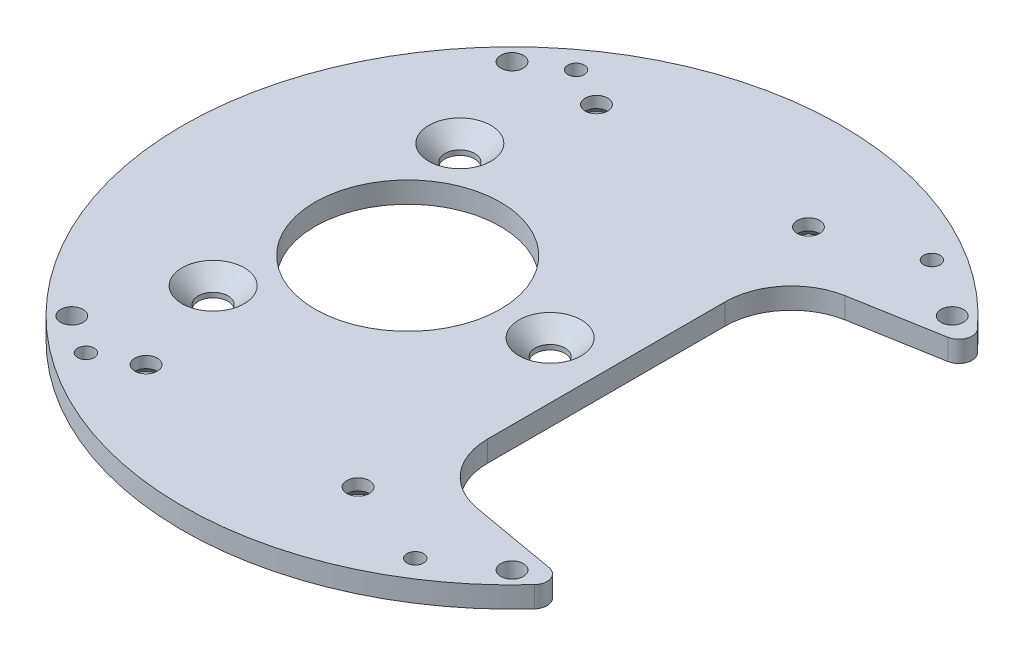
from build123d import *

# Parameters (mm, degrees)
SKETCH1_R                                       = 49.75
BOSS_EXTRUDE1_DEPTH                             = 3.175
CUT_EXTRUDE1_DEPTH                              = 71.428727271
SKETCH3_R                                       = 14
CUT_EXTRUDE2_DEPTH                              = 71.428727271
CIRPATTERN1_COUNT                               = 3
F_3_4_3_4_DIAMETER_HOLE1_D                      = 3.4
CIRPATTERN2_COUNT                               = 4
CSK_FOR_M3_FLAT_HEAD_MACHINE_SCREW2_D           = 3.4
CSK_FOR_M3_FLAT_HEAD_MACHINE_SCREW2_CSINK_D     = 6.3
CSK_FOR_M3_FLAT_HEAD_MACHINE_SCREW2_CSINK_ANGLE = 90
FILLET1_R                                       = 2
FILLET2_R                                       = 10
M3X0_5_TAPPED_HOLE1_D                           = 2.5


with BuildPart() as part:
    # Sketch1 → Boss-Extrude1 (new body)
    with BuildSketch(Plane(origin=(0, 0, 0), x_dir=(1, 0, 0), z_dir=(0, 1, 0))):
        Circle(SKETCH1_R)
    extrude(amount=BOSS_EXTRUDE1_DEPTH)

    # Sketch2 → Cut-Extrude1 (cut, through all)
    with BuildSketch(Plane(origin=(0, 3.175, 0), x_dir=(1, 0, 0), z_dir=(0, 1, 0))):
        with BuildLine():
            Line((33.834716203, 29.780120501), (14.25, 26.326806625))
            Line((14.25, 26.326806625), (14.25, -26.326806625))
            Line((14.25, -26.326806625), (39.136360913, -30.714943505))
            ThreePointArc((39.136360913, -30.714943505), (47.021784608, -16.248516003), (49.75, 0))
            ThreePointArc((49.75, 0), (47.021784608, 16.248516003), (39.136360913, 30.714943505))
            Line((39.136360913, 30.714943505), (33.834716203, 29.780120501))
        make_face()
    extrude(amount=-CUT_EXTRUDE1_DEPTH, mode=Mode.SUBTRACT)

    # Sketch3 → Cut-Extrude2 (cut, through all)
    with BuildSketch(Plane(origin=(0, 3.175, 0), x_dir=(1, 0, 0), z_dir=(0, 1, 0))):
        with Locations((-15.75, 0)):
            Circle(SKETCH3_R)
    extrude(amount=-CUT_EXTRUDE2_DEPTH, mode=Mode.SUBTRACT)

    # Sketch6 → CSK for M4 Flat Head Machine Screw1 (revolve, cut)
    with BuildSketch(Plane(origin=(5.75, 3.175, 0), x_dir=(0, 0, 1), z_dir=(1, 0, 0))):
        Polygon((0, 0), (0, 3.175), (2.25, 3.175), (2.25, 2.45), (4.7, 0), align=None)
    csk_for_m4_flat_head_machine_screw1 = revolve(axis=Axis((5.75, 9.525, 0), (0, -1, 0)), mode=Mode.SUBTRACT)

    # CirPattern1: CSK for M4 Flat Head Machine Screw1 ×3 about axis
    cirpattern1_axis = Axis((-15.75, 3.175, 0), (0, 1, 0))
    for i in range(1, CIRPATTERN1_COUNT):
        add(csk_for_m4_flat_head_machine_screw1.rotate(cirpattern1_axis, i * 360 / CIRPATTERN1_COUNT), mode=Mode.SUBTRACT)

    # Ø3.4 (3.4) Diameter Hole1 (through all)
    with Locations(Plane(origin=(0, 0, 0), x_dir=(-1, 0, 0), z_dir=(0, -1, 0))):
        with Locations((-33.226947648, 33.226947648)):
            f_3_4_3_4_diameter_hole1 = Hole(F_3_4_3_4_DIAMETER_HOLE1_D / 2)

    # CirPattern2: Ø3.4 (3.4) Diameter Hole1 ×4 about axis
    cirpattern2_axis = Axis((0, 3.175, 0), (0, -1, 0))
    for i in range(1, CIRPATTERN2_COUNT):
        add(f_3_4_3_4_diameter_hole1.rotate(cirpattern2_axis, i * 360 / CIRPATTERN2_COUNT), mode=Mode.SUBTRACT)

    # CSK for M3 Flat Head Machine Screw2 (through all)
    with Locations(Plane(origin=(0, 0, 0), x_dir=(-1, 0, 0), z_dir=(0, -1, 0))):
        with Locations((21.25, -34), (-10.75, -34), (-10.75, 34), (21.25, 34)):
            CounterSinkHole(CSK_FOR_M3_FLAT_HEAD_MACHINE_SCREW2_D / 2, CSK_FOR_M3_FLAT_HEAD_MACHINE_SCREW2_CSINK_D / 2, counter_sink_angle=CSK_FOR_M3_FLAT_HEAD_MACHINE_SCREW2_CSINK_ANGLE)

    # Fillet1
    fillet1_edges = [part.edges().sort_by_distance(p)[0] for p in [
        (39.136360913, 1.5875, 30.714943505),
        (39.136360913, 1.5875, -30.714943505),
    ]]
    fillet(fillet1_edges, radius=FILLET1_R)

    # Fillet2
    fillet2_edges = [part.edges().sort_by_distance(p)[0] for p in [
        (14.25, 1.5875, -26.326806625),
        (14.25, 1.5875, 26.326806625),
    ]]
    fillet(fillet2_edges, radius=FILLET2_R)

    # M3x0.5 Tapped Hole1 (through all)
    with Locations(Plane(origin=(0, 3.175, 0), x_dir=(1, 0, 0), z_dir=(0, 1, 0))):
        with Locations((-27.331300737, -37), (24.392621835, -39), (24.392621835, 39), (-27.331300737, 37)):
            Hole(M3X0_5_TAPPED_HOLE1_D / 2)


solid = part.part
